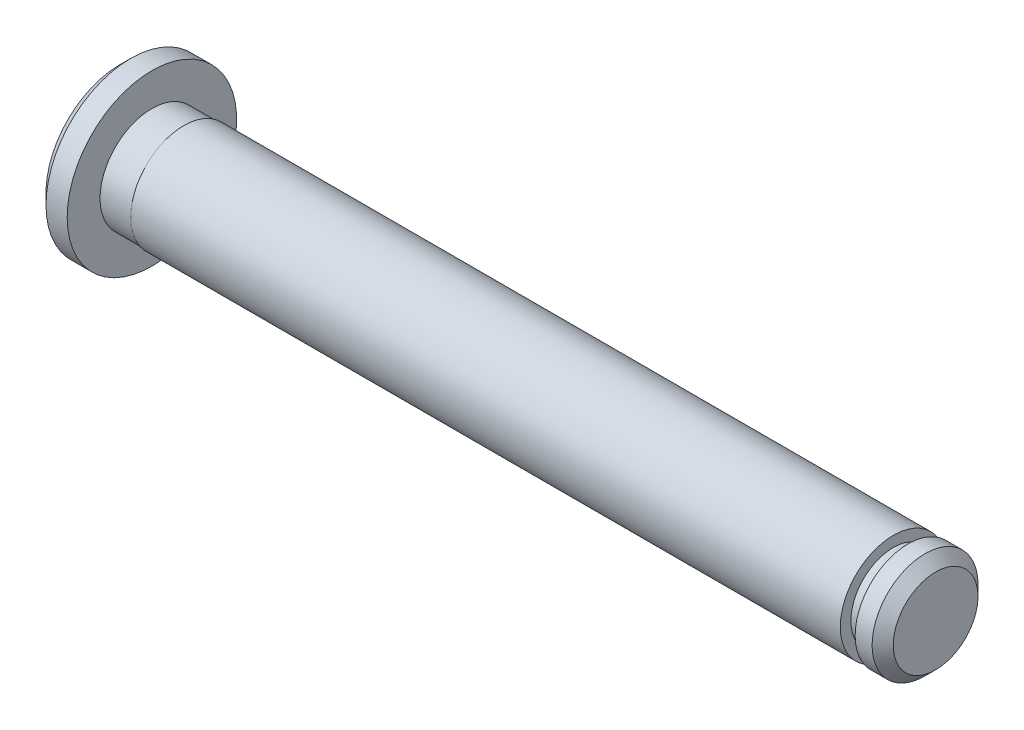
from build123d import *

# Parameters (mm, degrees)
CHAMFER1_SIZE = 0.5


with BuildPart() as part:
    # Sketch1 → Revolve1 (revolve)
    with BuildSketch(Plane.XY, mode=Mode.PRIVATE) as revolve1_sk:
        Polygon((-1.5, 0), (-1.5, 4), (0, 4), (0, 2.45), (1.5, 2.45), (1.5, 2.5), (35, 2.5), (35, 2), (35.7, 2), (35.7, 2.5), (37, 2.5), (37, 0), align=None)
    revolve(revolve1_sk.sketch.rotate(Axis((0, 0, 0), (1, 0, 0)), 90), axis=Axis((0, 0, 0), (1, 0, 0)))

    # Chamfer1
    chamfer1_edges = [part.edges().sort_by_distance(p)[0] for p in [
        (-1.5, 0, -4),
        (37, 0, -2.5),
    ]]
    chamfer(chamfer1_edges, length=CHAMFER1_SIZE)


solid = part.part
